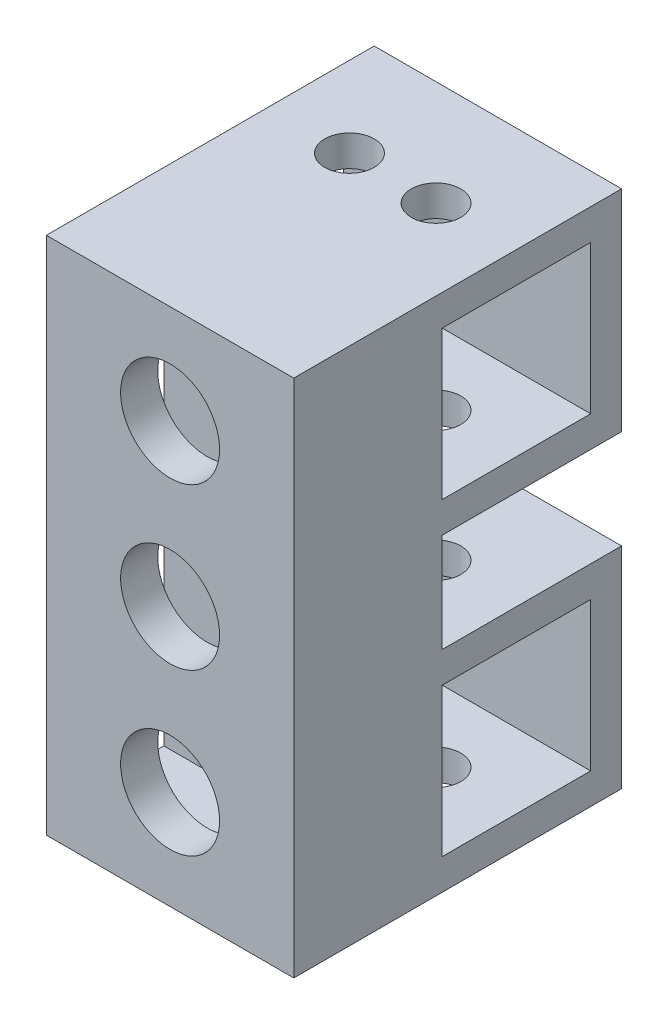
from build123d import *

# Parameters (mm, degrees)
ESQUISSE1_W             = 20
ESQUISSE1_H             = 42
BOSS_EXTRU_1_DEPTH      = 12
ESQUISSE2_W             = 20
ESQUISSE2_H             = 17
BOSS_EXTRU_3_DEPTH      = 14.5
ESQUISSE3_W             = 12
ESQUISSE3_H             = 12
ENL_V_MAT_EXTRU_3_DEPTH = 49.726276279
ESQUISSE4_R             = 2
ENL_V_MAT_EXTRU_4_DEPTH = 42
ENL_V_START             = -3
ENL_V_MAT_EXTRU_5_DEPTH = 6.5
ESQUISSE6_R             = 4
ENL_V_MAT_EXTRU_6_DEPTH = 13.5


with BuildPart() as part:
    # Esquisse1 → Boss.-Extru.1 (new body)
    with BuildSketch(Plane.XY):
        with Locations((10, -21)):
            Rectangle(ESQUISSE1_W, ESQUISSE1_H)
    extrude(amount=BOSS_EXTRU_1_DEPTH)

    # Esquisse2 → Boss.-Extru.3 (add)
    with BuildSketch(Plane(origin=(0, 0, 0), x_dir=(-1, 0, 0), z_dir=(0, 0, -1))):
        with Locations((-10, -33.5)):
            Rectangle(ESQUISSE2_W, ESQUISSE2_H)
    boss_extru_3 = extrude(amount=BOSS_EXTRU_3_DEPTH)

    # Esquisse3 → Enlèv. mat.-Extru.3 (cut, through all)
    with BuildSketch(Plane(origin=(20, 0, 0), x_dir=(0, 0, -1), z_dir=(1, 0, 0))):
        with Locations((6, -33.5)):
            Rectangle(ESQUISSE3_W, ESQUISSE3_H)
    enl_v_mat_extru_3 = extrude(amount=-ENL_V_MAT_EXTRU_3_DEPTH, mode=Mode.SUBTRACT)

    # Symétrie1: Boss.-Extru.3, Enlèv. mat.-Extru.3 across plane
    add(boss_extru_3.mirror(Plane(origin=(0, -21, 0), x_dir=(0, 0, 1), z_dir=(0, -1, 0))))
    add(enl_v_mat_extru_3.mirror(Plane(origin=(0, -21, 0), x_dir=(0, 0, 1), z_dir=(0, -1, 0))), mode=Mode.SUBTRACT)

    # Esquisse4 → Enlèv. mat.-Extru.4 (cut)
    with BuildSketch(Plane.XZ.offset(42)):
        with Locations(Location((13.5, -6, 0), (0, 0, 270))):
            Circle(ESQUISSE4_R)
        with Locations(Location((6.5, -6, 0), (0, 0, 270))):
            Circle(ESQUISSE4_R)
    extrude(amount=-ENL_V_MAT_EXTRU_4_DEPTH, mode=Mode.SUBTRACT)

    # Esquisse5 → Enlèv. mat.-Extru.5 (cut)
    with BuildSketch(Plane.XY.offset(12).offset(ENL_V_START)):
        Polygon((13.75277675, -27.5), (17.505553499, -21), (13.75277675, -14.5), (6.24722325, -14.5), (2.494446501, -21), (6.24722325, -27.5), align=None)
        Polygon((6.24722325, -27.5), (2.494446501, -34), (6.24722325, -40.5), (13.75277675, -40.5), (17.505553499, -34), (13.75277675, -27.5), align=None)
        Polygon((0, -40.5), (6.24722325, -40.5), (2.494446501, -34), (6.24722325, -27.5), (2.494446501, -21), (6.24722325, -14.5), (2.494446501, -8), (6.24722325, -1.5), (0, -1.5), align=None)
        Polygon((2.494446501, -8), (6.24722325, -14.5), (13.75277675, -14.5), (17.505553499, -8), (13.75277675, -1.5), (6.24722325, -1.5), align=None)
    extrude(amount=-ENL_V_MAT_EXTRU_5_DEPTH, mode=Mode.SUBTRACT)

    # Esquisse6 → Enlèv. mat.-Extru.6 (cut)
    with BuildSketch(Plane.XY.offset(12)):
        with Locations((10, -34)):
            Circle(ESQUISSE6_R)
        with Locations((10, -21)):
            Circle(ESQUISSE6_R)
        with Locations((10, -8)):
            Circle(ESQUISSE6_R)
    extrude(amount=-ENL_V_MAT_EXTRU_6_DEPTH, mode=Mode.SUBTRACT)


solid = part.part
